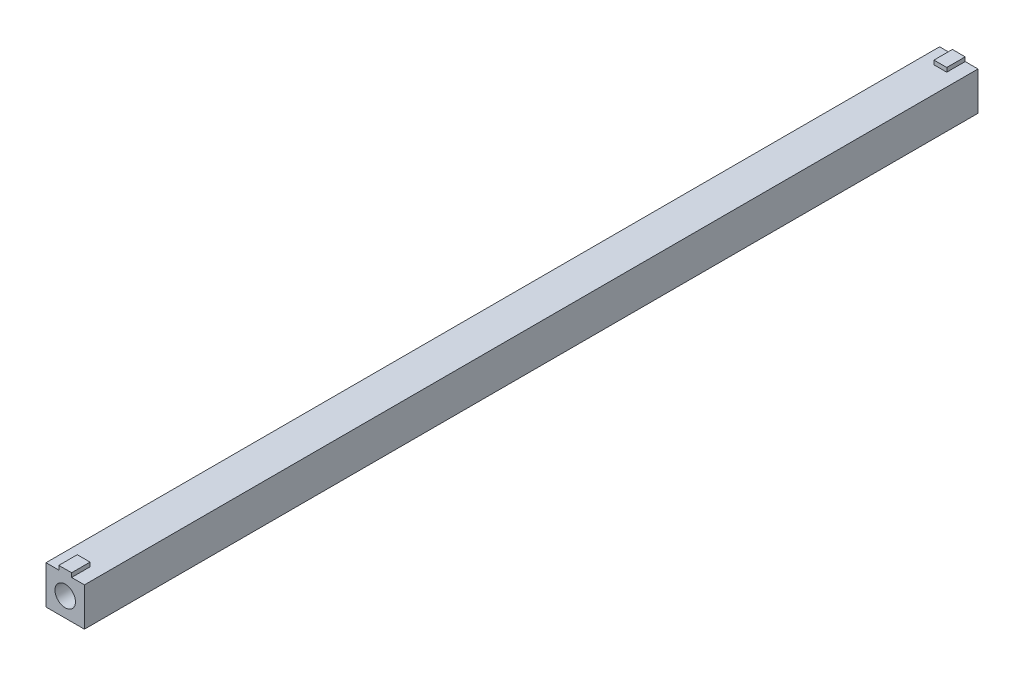
from build123d import *

# Parameters (mm, degrees)
SKETCH_1_W      = 30
SKETCH_1_H      = 30
SKETCH_1_R      = 8
EXTRUDE_1_DEPTH = 697.8
SKETCH_2_W      = 10
SKETCH_2_H      = 3.2
EXTRUDE_2_DEPTH = 14.4


with BuildPart() as part:
    # 草图1 → 凸台-拉伸1 (new body)
    with BuildSketch(Plane.XY):
        Rectangle(SKETCH_1_W, SKETCH_1_H)
        Circle(SKETCH_1_R, mode=Mode.SUBTRACT)
    extrude(amount=EXTRUDE_1_DEPTH)

    # 草图2 → 凸台-拉伸2 (add)
    with BuildSketch(Plane.XY.offset(697.8)):
        with Locations((0, 16.6)):
            Rectangle(SKETCH_2_W, SKETCH_2_H)
    extrude_2 = extrude(amount=-EXTRUDE_2_DEPTH)

    # 镜向1: 凸台-拉伸2 across plane
    add(extrude_2.mirror(Plane.XY.offset(348.9)))


solid = part.part
